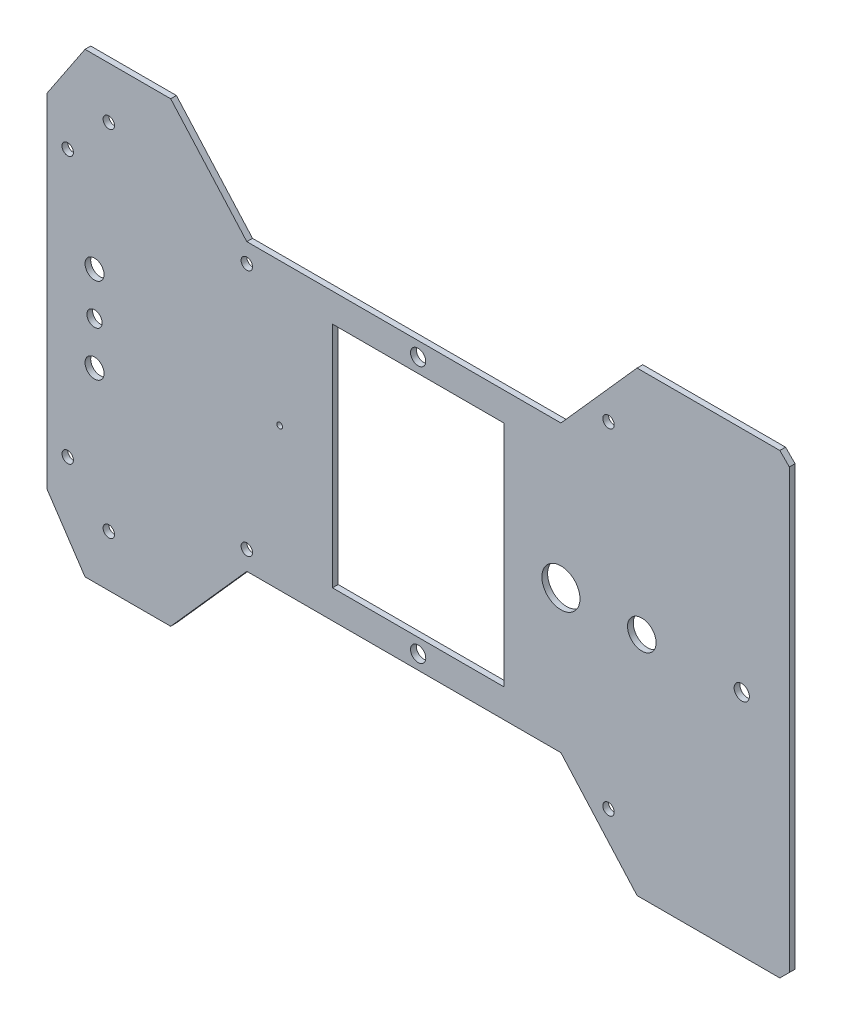
from build123d import *

# Parameters (mm, degrees)
SKETCH_1_R           = 3
SKETCH_1_W           = 90
SKETCH_1_H           = 120
SKETCH_1_R_2         = 10
SKETCH_1_R_3         = 7.5
EXTRUDE_2_DEPTH      = 3
EXTRUDE_START        = -10
SKETCH_2_R           = 7.5
EXTRUDE_3_DEPTH      = 10
CUT_EXTRUDE_1_DEPTH  = 10
EXTRUDE_START_2      = -3
SKETCH_4_R           = 10
EXTRUDE_4_DEPTH      = 3
SKETCH_6_W           = 7
SKETCH_6_H           = 14.142135624
CUT_EXTRUDE_5_DEPTH  = 333.489097566
SKETCH_7_W           = 90
SKETCH_7_H           = 120
EXTRUDE_5_DEPTH      = 3
SKETCH_8_W           = 10
SKETCH_8_H           = 50
EXTRUDE_6_DEPTH      = 30
SKETCH_9_R           = 8
CUT_EXTRUDE_6_DEPTH  = 30
SKETCH_10_R          = 3
EXTRUDE_7_DEPTH      = 3
SKETCH_11_R          = 3
CUT_EXTRUDE_7_DEPTH  = 3
SKETCH_12_R          = 3
EXTRUDE_8_DEPTH      = 3
SKETCH_13_R          = 3
CUT_EXTRUDE_8_DEPTH  = 3
SKETCH_14_R          = 3
CUT_EXTRUDE_9_DEPTH  = 10
SKETCH_15_R          = 3
CUT_EXTRUDE_10_DEPTH = 231.922064775
SKETCH_16_R          = 3
EXTRUDE_10_DEPTH     = 3
SKETCH_17_R          = 3
CUT_EXTRUDE_11_DEPTH = 231.922064775
SKETCH_18_R          = 5
CUT_EXTRUDE_12_DEPTH = 10
SKETCH_19_W          = 30
SKETCH_19_H          = 50
CUT_EXTRUDE_13_DEPTH = 10
EXTRUDE_11_DEPTH     = 3
EXTRUDE_12_DEPTH     = 3
CUT_EXTRUDE_14_DEPTH = 3
SKETCH_23_W          = 90
SKETCH_23_H          = 120
CUT_EXTRUDE_15_DEPTH = 3
SKETCH_24_R          = 10
SKETCH_24_R_2        = 7.5
CUT_EXTRUDE_16_DEPTH = 3
SKETCH_25_R          = 1.5
CUT_EXTRUDE_17_DEPTH = 10
SKETCH_26_R          = 4
CUT_EXTRUDE_18_DEPTH = 10
SKETCH_27_R          = 4
CUT_EXTRUDE_19_DEPTH = 10


with BuildPart() as part:
    # 草图1 → 凸台-拉伸2 (new body)
    # profile 1 of 9: a face of its own
    with BuildSketch(Plane.XY):
        Polygon((195, -115), (195, 115), (190, 115), (190, 120), (115, 120), (115, 75), (75, 75), (-90, 75), (-130, 75), (-130, 120), (-175, 120), (-175, 90), (-195, 90), (-195, -90), (-175, -90), (-175, -120), (-130, -120), (-130, -75), (-90, -75), (75, -75), (115, -75), (115, -120), (190, -120), (190, -115), align=None)
        with Locations((-184.089468205, -70)):
            Circle(SKETCH_1_R, mode=Mode.SUBTRACT)
        with Locations((-87, -69)):
            Circle(SKETCH_1_R, mode=Mode.SUBTRACT)
        with Locations((-184.089468205, 70)):
            Circle(SKETCH_1_R, mode=Mode.SUBTRACT)
        with Locations((-87, 69)):
            Circle(SKETCH_1_R, mode=Mode.SUBTRACT)
        Rectangle(SKETCH_1_W, SKETCH_1_H, mode=Mode.SUBTRACT)
        with Locations((75, 0)):
            Circle(SKETCH_1_R_2, mode=Mode.SUBTRACT)
        with Locations((117.5, 0)):
            Circle(SKETCH_1_R_3, mode=Mode.SUBTRACT)
    # profile 2 of 9: a face of its own
    with BuildSketch(Plane.XY):
        Polygon((-130, 120), (-90, 75), (-130, 75), align=None)
    # profile 3 of 9: a face of its own
    with BuildSketch(Plane.XY):
        Polygon((-175, 120), (-175, 90), (-195, 90), align=None)
    # profile 4 of 9: a face of its own
    with BuildSketch(Plane.XY):
        Polygon((-175, -120), (-195, -90), (-175, -90), align=None)
    # profile 5 of 9: a face of its own
    with BuildSketch(Plane.XY):
        Polygon((-130, -120), (-130, -75), (-90, -75), align=None)
    # profile 6 of 9: a face of its own
    with BuildSketch(Plane.XY):
        Polygon((115, -120), (75, -75), (115, -75), align=None)
        with Locations((104.379549532, -93)):
            Circle(SKETCH_1_R, mode=Mode.SUBTRACT)
    # profile 7 of 9: a face of its own
    with BuildSketch(Plane.XY):
        Polygon((115, 120), (115, 75), (75, 75), align=None)
        with Locations((104.379549532, 93)):
            Circle(SKETCH_1_R, mode=Mode.SUBTRACT)
    # profile 8 of 9: a face of its own
    with BuildSketch(Plane.XY):
        Polygon((190, 120), (195, 115), (190, 115), align=None)
    # profile 9 of 9: a face of its own
    with BuildSketch(Plane.XY):
        Polygon((190, -115), (190, -120), (195, -115), align=None)
    extrude(amount=EXTRUDE_2_DEPTH)

    # 草图2 → 凸台-拉伸3 (add)
    with BuildSketch(Plane.XY.offset(3).offset(EXTRUDE_START)):
        with Locations((117.5, 0)):
            Circle(SKETCH_2_R)
    extrude(amount=EXTRUDE_3_DEPTH)

    # 草图3 → 切除-拉伸1 (cut)
    with BuildSketch(Plane.XY.offset(3)):
        Polygon((115, 120), (115, -120), (190, -120), (195, -115), (195, 115), (190, 120), align=None)
        Polygon((115, -120), (115, -114.375), (110, -114.375), align=None)
        Polygon((115, 114.376866735), (115, 120), (110.00165932, 114.376866735), align=None)
    extrude(amount=-CUT_EXTRUDE_1_DEPTH, mode=Mode.SUBTRACT)

    # 草图4 → 凸台-拉伸4 (add)
    with BuildSketch(Plane.XY.offset(3).offset(EXTRUDE_START_2)):
        with Locations((75, 0)):
            Circle(SKETCH_4_R)
    extrude(amount=EXTRUDE_4_DEPTH)

    # 草图6 → 切除-拉伸5 (cut, through all)
    with BuildSketch(Plane(origin=(115, 0, 0), x_dir=(0, 0, -1), z_dir=(1, 0, 0))):
        with Locations((3.5, 0)):
            Rectangle(SKETCH_6_W, SKETCH_6_H)
    extrude(amount=-CUT_EXTRUDE_5_DEPTH, mode=Mode.SUBTRACT)

    # 草图7 → 凸台-拉伸5 (add)
    with BuildSketch(Plane.XY.offset(3)):
        Rectangle(SKETCH_7_W, SKETCH_7_H)
    extrude(amount=-EXTRUDE_5_DEPTH)

    # 草图8 → 凸台-拉伸6 (add)
    with BuildSketch(Plane.XY.offset(3)):
        with Locations((110, 0)):
            Rectangle(SKETCH_8_W, SKETCH_8_H)
    extrude(amount=EXTRUDE_6_DEPTH)

    # 草图9 → 切除-拉伸6 (cut)
    with BuildSketch(Plane(origin=(115, 0, 0), x_dir=(0, 0, -1), z_dir=(1, 0, 0))):
        with Locations((-17.93158575, 0)):
            Circle(SKETCH_9_R)
    extrude(amount=-CUT_EXTRUDE_6_DEPTH, mode=Mode.SUBTRACT)

    # 草图10 → 凸台-拉伸7 (add)
    with BuildSketch(Plane.XY.offset(3).offset(EXTRUDE_START_2)):
        with Locations((104.379549532, -93)):
            Circle(SKETCH_10_R)
        with Locations((104.379549532, 93)):
            Circle(SKETCH_10_R)
    extrude(amount=EXTRUDE_7_DEPTH)

    # 草图11 → 切除-拉伸7 (cut)
    with BuildSketch(Plane.XY.offset(3)):
        with Locations((100, -88.073006777)):
            Circle(SKETCH_11_R)
        with Locations(Location((100, 88.073006777, 0), (0, 0, 180))):
            Circle(SKETCH_11_R)
    extrude(amount=-CUT_EXTRUDE_7_DEPTH, mode=Mode.SUBTRACT)

    # 草图12 → 凸台-拉伸8 (add)
    with BuildSketch(Plane.XY.offset(3).offset(EXTRUDE_START_2)):
        with Locations((-87, 69)):
            Circle(SKETCH_12_R)
        with Locations((-87, -69)):
            Circle(SKETCH_12_R)
    extrude(amount=EXTRUDE_8_DEPTH)

    # 草图13 → 切除-拉伸8 (cut)
    with BuildSketch(Plane.XY.offset(3)):
        with Locations((-90, 65)):
            Circle(SKETCH_13_R)
        with Locations(Location((-90, -65, 0), (0, 0, 180))):
            Circle(SKETCH_13_R)
    extrude(amount=-CUT_EXTRUDE_8_DEPTH, mode=Mode.SUBTRACT)

    # 草图14 → 切除-拉伸9 (cut)
    with BuildSketch(Plane.XY.offset(3)):
        with BuildLine():
            ThreePointArc((-159.5, 88), (-160.378679656, 90.121320344), (-162.5, 91))
            Line((-162.5, 91), (-162.5, 85))
            ThreePointArc((-162.5, 85), (-160.378679656, 85.878679656), (-159.5, 88))
        make_face()
        with BuildLine():
            Line((-162.5, 85), (-162.5, 91))
            ThreePointArc((-162.5, 91), (-165.5, 88), (-162.5, 85))
        make_face()
        with Locations((-162.5, -88)):
            Circle(SKETCH_14_R)
    extrude(amount=-CUT_EXTRUDE_9_DEPTH, mode=Mode.SUBTRACT)

    # 草图15 → 切除-拉伸10 (cut, through all)
    with BuildSketch(Plane.XY.offset(3)):
        with Locations((-162.5, -93)):
            Circle(SKETCH_15_R)
        with Locations((-162.5, -88)):
            Circle(SKETCH_15_R)
        with Locations((-162.5, 93)):
            Circle(SKETCH_15_R)
        with Locations((-162.5, 88)):
            Circle(SKETCH_15_R)
    extrude(amount=-CUT_EXTRUDE_10_DEPTH, mode=Mode.SUBTRACT)

    # 草图16 → 凸台-拉伸10 (add)
    with BuildSketch(Plane.XY.offset(3)):
        with Locations((-162.5, 88)):
            Circle(SKETCH_16_R)
        with Locations((-162.5, -88)):
            Circle(SKETCH_16_R)
    extrude(amount=-EXTRUDE_10_DEPTH)

    # 草图17 → 切除-拉伸11 (cut, through all)
    with BuildSketch(Plane.XY.offset(3)):
        with Locations((-162.5, 93)):
            Circle(SKETCH_17_R)
        with Locations((-162.5, -93)):
            Circle(SKETCH_17_R)
    extrude(amount=-CUT_EXTRUDE_11_DEPTH, mode=Mode.SUBTRACT)

    # 草图18 → 切除-拉伸12 (cut)
    with BuildSketch(Plane.XY.offset(3)):
        with Locations((-170, 22.5)):
            Circle(SKETCH_18_R)
        with Locations((-170, -22.5)):
            Circle(SKETCH_18_R)
    extrude(amount=-CUT_EXTRUDE_12_DEPTH, mode=Mode.SUBTRACT)

    # 草图19 → 切除-拉伸13 (cut)
    with BuildSketch(Plane.ZY.offset(-105)):
        with Locations((18, 0)):
            Rectangle(SKETCH_19_W, SKETCH_19_H)
    extrude(amount=-CUT_EXTRUDE_13_DEPTH, mode=Mode.SUBTRACT)

    # 草图20 → 凸台-拉伸11 (add)
    with BuildSketch(Plane.XY.offset(3)):
        Polygon((195, 0.000933368), (115, 0.000933368), (115, -114.375), (115, -119.998133265), (195, -119.998133265), align=None)
        Polygon((115, 120), (115, 114.376866735), (115, 0.000933368), (195, 0.000933368), (195, 120), align=None)
    extrude(amount=-EXTRUDE_11_DEPTH)

    # 草图21 → 凸台-拉伸12 (add)
    with BuildSketch(Plane.XY.offset(3)):
        Polygon((115, 120), (110.00165932, 114.376866735), (115, 114.376866735), align=None)
        Polygon((110, -114.375), (115, -119.998133265), (115, -114.375), align=None)
    extrude(amount=-EXTRUDE_12_DEPTH)

    # 草图22 → 切除-拉伸14 (cut)
    with BuildSketch(Plane.XY.offset(3)):
        Polygon((195, 115), (195, 120), (190, 120), align=None)
        Polygon((195, -120), (190, -120), (195, -115), align=None)
    extrude(amount=-CUT_EXTRUDE_14_DEPTH, mode=Mode.SUBTRACT)

    # 草图23 → 切除-拉伸15 (cut)
    with BuildSketch(Plane.XY.offset(3)):
        Rectangle(SKETCH_23_W, SKETCH_23_H)
    extrude(amount=-CUT_EXTRUDE_15_DEPTH, mode=Mode.SUBTRACT)

    # 草图24 → 切除-拉伸16 (cut)
    with BuildSketch(Plane.XY.offset(3)):
        with Locations((75, 0)):
            Circle(SKETCH_24_R)
        with Locations((117.5, 0)):
            Circle(SKETCH_24_R_2)
    extrude(amount=-CUT_EXTRUDE_16_DEPTH, mode=Mode.SUBTRACT)

    # 草图25 → 切除-拉伸17 (cut)
    with BuildSketch(Plane.XY.offset(3)):
        with Locations((-72.75, 0)):
            Circle(SKETCH_25_R)
    extrude(amount=-CUT_EXTRUDE_17_DEPTH, mode=Mode.SUBTRACT)

    # 草图26 → 切除-拉伸18 (cut)
    with BuildSketch(Plane.XY.offset(3)):
        with Locations((-170, 0)):
            Circle(SKETCH_26_R)
    extrude(amount=-CUT_EXTRUDE_18_DEPTH, mode=Mode.SUBTRACT)

    # 草图27 → 切除-拉伸19 (cut)
    with BuildSketch(Plane.XY.offset(3)):
        with Locations((0, -67.5)):
            Circle(SKETCH_27_R)
        with Locations((0, 67.5)):
            Circle(SKETCH_27_R)
        with Locations((-170, 0)):
            Circle(SKETCH_27_R)
        with Locations((170, 0)):
            Circle(SKETCH_27_R)
    extrude(amount=-CUT_EXTRUDE_19_DEPTH, mode=Mode.SUBTRACT)


solid = part.part
